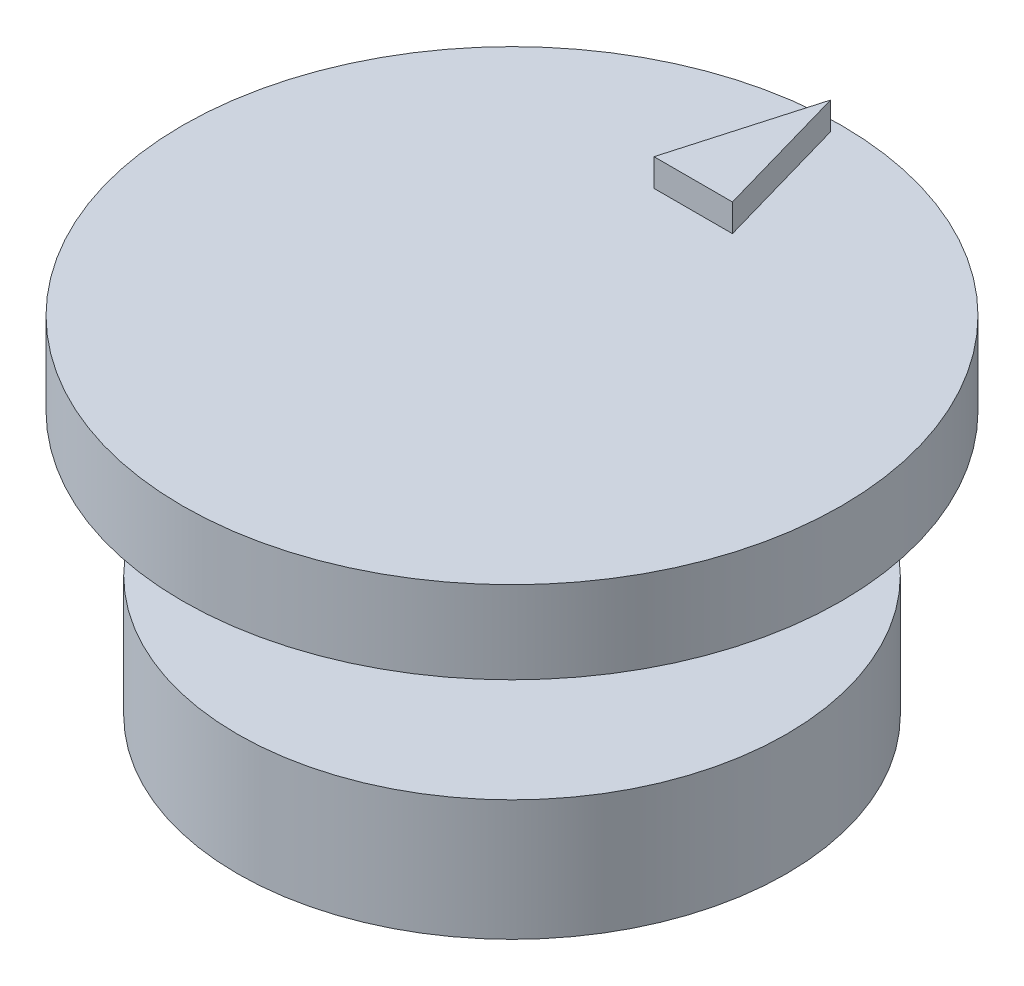
from build123d import *

# Parameters (mm, degrees)
ARROW_DEPTH = 1.27
SKETCH3_R   = 2.286
FLAG_DEPTH  = 6.35


with BuildPart() as part:
    # Sketch1 → dial base shape (revolve)
    with BuildSketch(Plane.XY, mode=Mode.PRIVATE) as dial_base_shape_sk:
        Polygon((0, -20.891058424), (0, -36.893058424), (12.7, -36.893058424), (12.7, -31.305058424), (3.175, -31.305058424), (3.175, -26.225058424), (12.7, -26.225058424), (12.7, -24.701058424), (15.24, -24.701058424), (15.24, -20.891058424), align=None)
    revolve(dial_base_shape_sk.sketch.rotate(Axis((0, -20.891058424, 0), (0, -1, 0)), 180), axis=Axis((0, -20.891058424, 0), (0, -1, 0)))

    # Sketch2 → arrow (add)
    with BuildSketch(Plane(origin=(0, -20.891058424, 0), x_dir=(1, 0, 0), z_dir=(0, 1, 0))):
        Polygon((0, 14.732), (-1.813922821, 8.382), (1.813922821, 8.382), align=None)
    extrude(amount=ARROW_DEPTH)

    # Sketch3 → flag (add)
    with BuildSketch(Plane.XZ.offset(36.893058424)):
        with Locations(Location((0, -9.854910999, 0), (0, 0, 180))):
            Circle(SKETCH3_R)
    extrude(amount=FLAG_DEPTH)


solid = part.part
